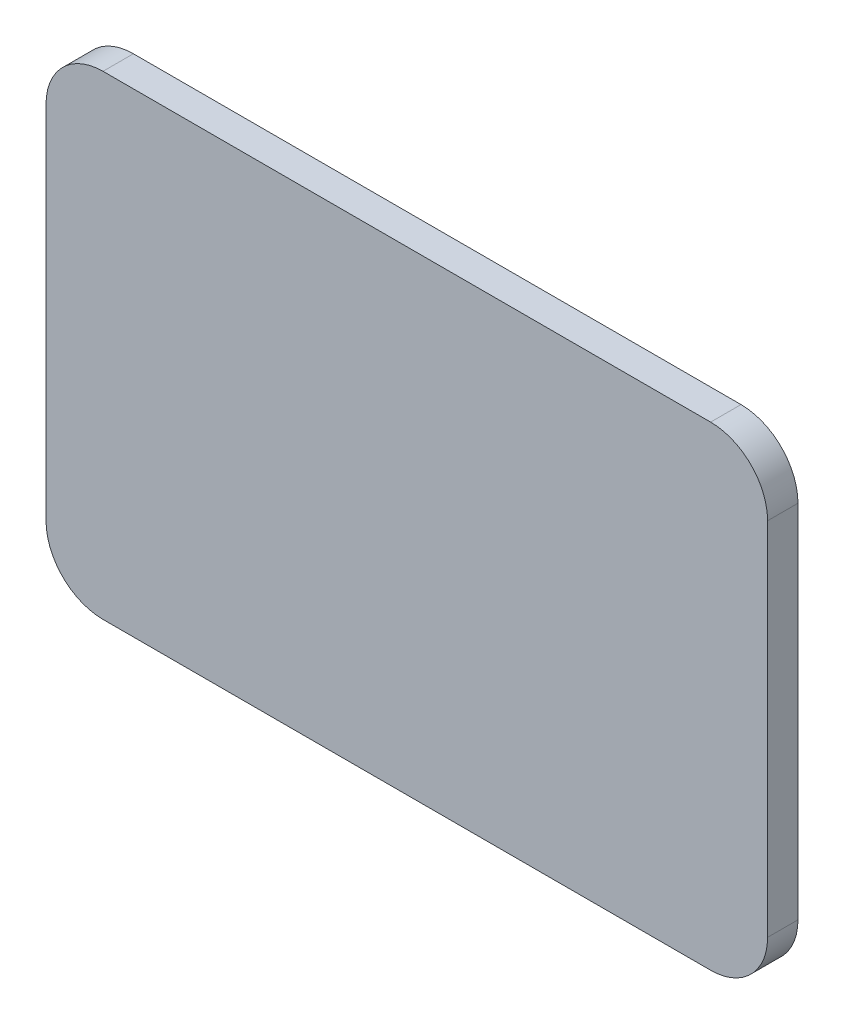
from build123d import *

# Parameters (mm, degrees)
SKETCH_1_W      = 380
SKETCH_1_H      = 250
EXTRUDE_1_DEPTH = 16
FILLET_1_R      = 30


with BuildPart() as part:
    # 草图1 → 凸台-拉伸1 (new body)
    with BuildSketch(Plane.XY):
        Rectangle(SKETCH_1_W, SKETCH_1_H)
    extrude(amount=EXTRUDE_1_DEPTH)

    # 圆角1
    fillet_1_edges = [part.edges().sort_by_distance(p)[0] for p in [
        (-190, 125, 8),
        (190, 125, 8),
        (190, -125, 8),
        (-190, -125, 8),
    ]]
    fillet(fillet_1_edges, radius=FILLET_1_R)


solid = part.part
